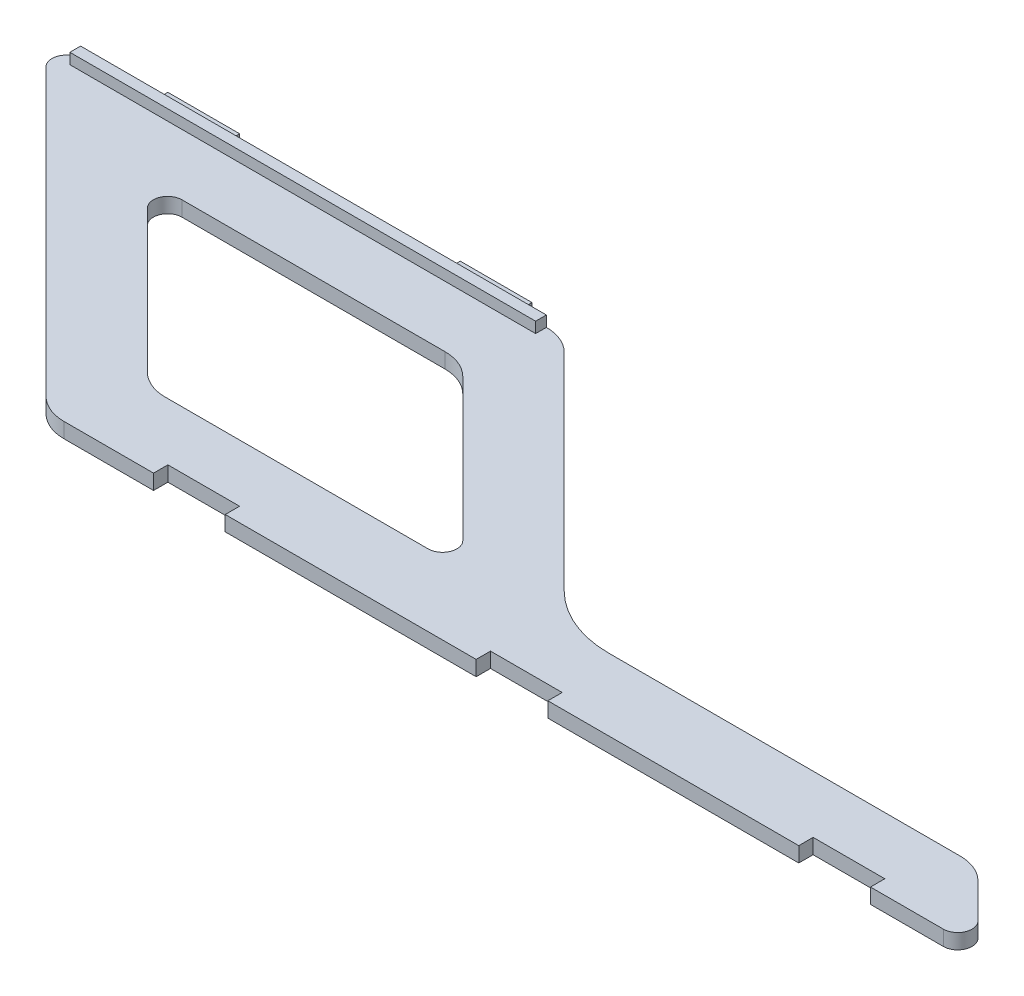
from build123d import *

# Parameters (mm, degrees)
BOSS_EXTRUDE1_DEPTH = 2.1
SKETCH2_W           = 64.966291501
SKETCH2_H           = 1.5
BOSS_EXTRUDE2_DEPTH = 1.5


with BuildPart() as part:
    # Sketch1 → Boss-Extrude1 (new body)
    with BuildSketch(Plane(origin=(0, 0, 0), x_dir=(1, 0, 0), z_dir=(0, 1, 0))):
        with BuildLine():
            Line((4.828427125, 0), (15, 0))
            Line((15, 0), (15, 2))
            Line((15, 2), (25, 2))
            Line((25, 2), (25, 0))
            Line((25, 0), (55.78, 0))
            Line((55.78, 0), (55.78, 2))
            Line((55.78, 2), (65.78, 2))
            Line((65.78, 2), (65.78, 0))
            Line((65.78, 0), (69.794718626, 0))
            ThreePointArc((69.794718626, 0), (72.09081922, -0.456722805), (74.037359313, -1.757359313))
            Line((74.037359313, -1.757359313), (102.886601718, -30.606601718))
            ThreePointArc((102.886601718, -30.606601718), (107.75295195, -33.858192988), (113.493203436, -35))
            Line((113.493203436, -35), (162.514718626, -35))
            ThreePointArc((162.514718626, -35), (164.81081922, -35.456722805), (166.757359313, -36.757359313))
            Line((166.757359313, -36.757359313), (171.585786438, -41.585786438))
            ThreePointArc((171.585786438, -41.585786438), (172.01933194, -43.765366865), (170.171572875, -45))
            Line((170.171572875, -45), (160, -45))
            Line((160, -45), (160, -43))
            Line((160, -43), (150, -43))
            Line((150, -43), (150, -45))
            Line((150, -45), (115, -45))
            Line((115, -45), (115, -43))
            Line((115, -43), (105, -43))
            Line((105, -43), (105, -45))
            Line((105, -45), (70, -45))
            Line((70, -45), (70, -43))
            Line((70, -43), (60, -43))
            Line((60, -43), (60, -45))
            Line((60, -45), (47.485281374, -45))
            ThreePointArc((47.485281374, -45), (45.18918078, -44.543277195), (43.242640687, -43.242640687))
            Line((43.242640687, -43.242640687), (3.414213562, -3.414213562))
            ThreePointArc((3.414213562, -3.414213562), (2.98066806, -1.234633135), (4.828427125, 0))
        make_face()
        with BuildLine():
            Line((28.970562748, -10), (65.652583002, -10))
            ThreePointArc((65.652583002, -10), (67.948683596, -10.456722805), (69.895223689, -11.757359313))
            Line((69.895223689, -11.757359313), (89.723650814, -31.585786438))
            ThreePointArc((89.723650814, -31.585786438), (90.157196317, -33.765366865), (88.309437252, -35))
            Line((88.309437252, -35), (51.627416998, -35))
            ThreePointArc((51.627416998, -35), (49.331316404, -34.543277195), (47.384776311, -33.242640687))
            Line((47.384776311, -33.242640687), (27.556349186, -13.414213562))
            ThreePointArc((27.556349186, -13.414213562), (27.122803683, -11.234633135), (28.970562748, -10))
        make_face(mode=Mode.SUBTRACT)
    extrude(amount=BOSS_EXTRUDE1_DEPTH)

    # Sketch2 → Boss-Extrude2 (add)
    with BuildSketch(Plane(origin=(0, 2.1, 0), x_dir=(1, 0, 0), z_dir=(0, 1, 0))):
        with Locations((37.311572876, -0.75)):
            Rectangle(SKETCH2_W, SKETCH2_H)
    extrude(amount=BOSS_EXTRUDE2_DEPTH)


solid = part.part
